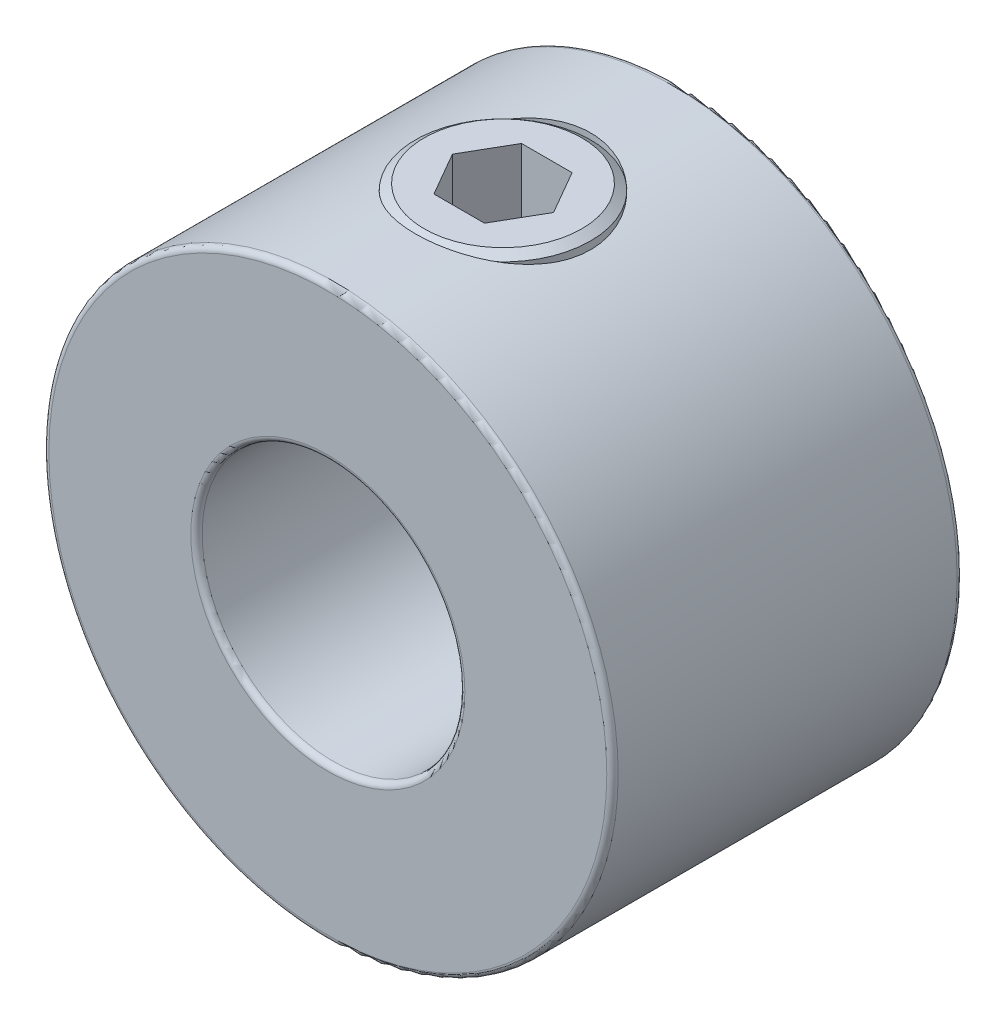
from build123d import *

# Parameters (mm, degrees)
SKETCH1_R          = 6.5
SKETCH1_R_2        = 3
EXTRUDE1_DEPTH     = 8
CUT_EXTRUDE1_REACH = 18.591
SKETCH2_R          = 2
CUT_EXTRUDE2_DEPTH = 1.6
FILLET1_R          = 0.13


with BuildPart() as part:
    # Sketch1 → Extrude1 (new body)
    with BuildSketch(Plane.XY):
        Circle(SKETCH1_R)
        Circle(SKETCH1_R_2, mode=Mode.SUBTRACT)
    extrude(amount=EXTRUDE1_DEPTH)

    # Sketch2 → Cut-Extrude1 (cut, up to next)
    with BuildSketch(Plane(origin=(0, 6.5, 0), x_dir=(-1, 0, 0), z_dir=(0, 1, 0)), mode=Mode.PRIVATE) as cut_extrude1_sk1:
        with Locations((0, 4)):
            Circle(SKETCH2_R)
    cut_extrude1_tool1 = extrude(cut_extrude1_sk1.sketch, amount=-CUT_EXTRUDE1_REACH, mode=Mode.PRIVATE) & part.part
    add(cut_extrude1_tool1.solids().sort_by_distance((0, 6.5, 4))[0], mode=Mode.SUBTRACT)

    # Fillet1
    fillet1_edges = [part.edges().sort_by_distance(p)[0] for p in [
        (-3, 0, 0),
        (-3, 0, 8),
        (-6.5, 0, 0),
        (-6.5, 0, 8),
    ]]
    fillet(fillet1_edges, radius=FILLET1_R)


with BuildPart() as body_2:
    # Sketch3 → Revolve1 (revolve)
    with BuildSketch(Plane.XY.offset(4)):
        Polygon((-1.8, 6.5), (-2, 6.359958492), (-2, 3.404070187), (-1.095929813, 2.5), (0, 3.158501066), (0, 6.5), align=None)
    revolve(axis=Axis((0, 3.158501066, 4), (0, 1, 0)))

    # Sketch4 → Cut-Extrude2 (cut)
    with BuildSketch(Plane(origin=(0, 6.5, 0), x_dir=(0, 0, -1), z_dir=(0, 1, 0))):
        Polygon((-4, 1.154700538), (-5, 0.577350269), (-5, -0.577350269), (-4, -1.154700538), (-3, -0.577350269), (-3, 0.577350269), align=None)
    extrude(amount=-CUT_EXTRUDE2_DEPTH, mode=Mode.SUBTRACT)


solid = Compound([part.part, body_2.part])
